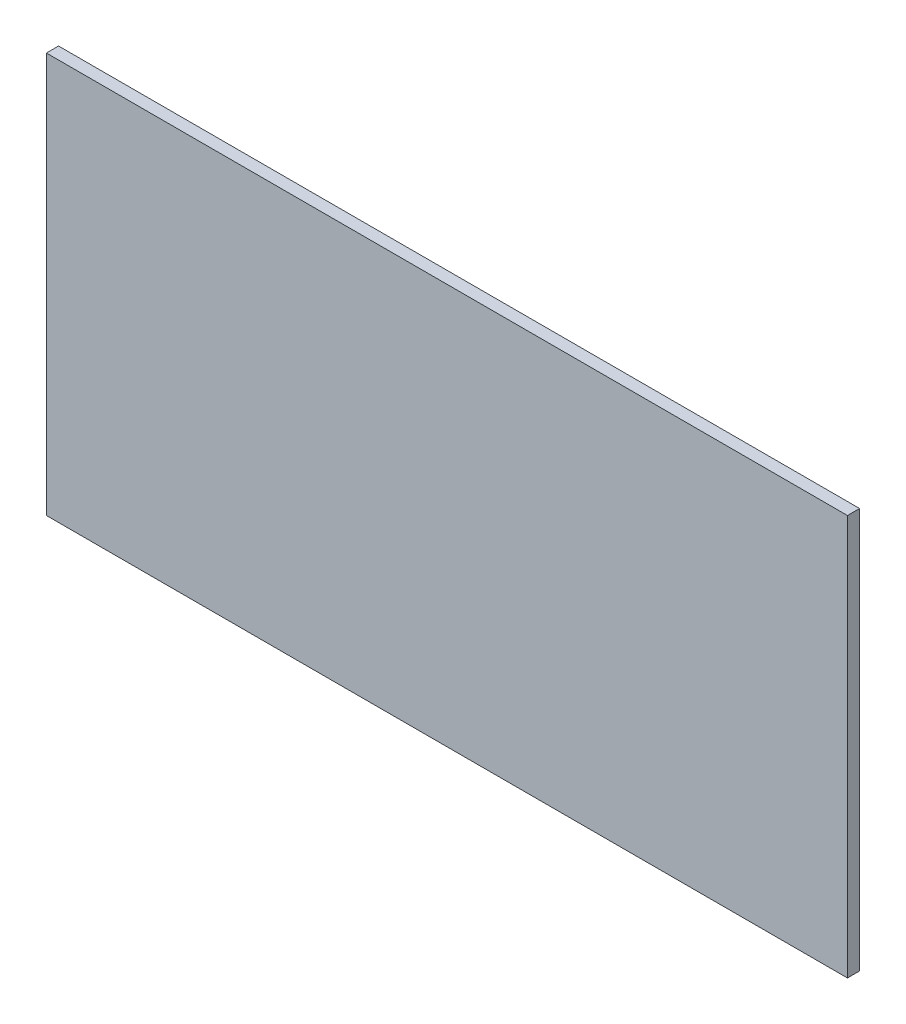
from build123d import *

# Parameters (mm, degrees)
SKETCH_1_W      = 132
SKETCH_1_H      = 66
EXTRUDE_1_DEPTH = 2


with BuildPart() as part:
    # 草图1 → 凸台-拉伸1 (new body)
    with BuildSketch(Plane.XY):
        with Locations((30.687898089, 5.077028856)):
            Rectangle(SKETCH_1_W, SKETCH_1_H)
    extrude(amount=EXTRUDE_1_DEPTH)


solid = part.part
